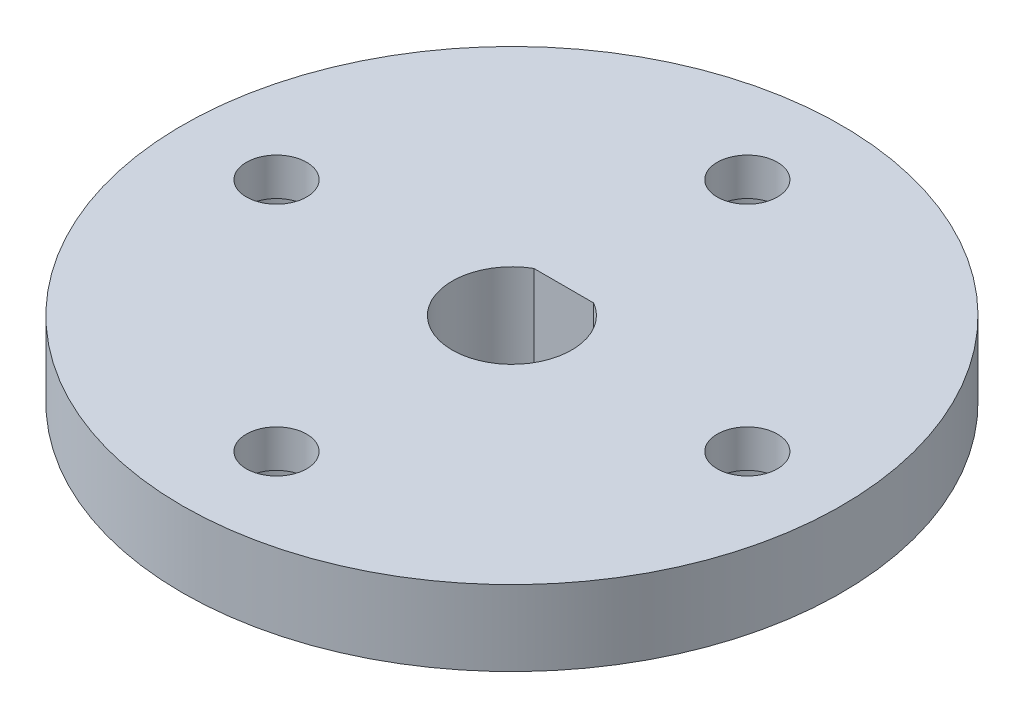
from build123d import *

# Parameters (mm, degrees)
SKETCH1_R               = 17.5
BOSS_EXTRUDE1_DEPTH     = 4
BOSS_EXTRUDE2_DEPTH     = 6
CUT_EXTRUDE1_DEPTH      = 26.465663156
CUT_EXTRUDE1_DEPTH_BACK = 26.465663156
SKETCH3_R               = 1.6
CUT_EXTRUDE2_DEPTH      = 1
CUT_EXTRUDE2_DEPTH_BACK = 23.716032156
CUT_EXTRUDE2_START      = -2.749631
SKETCH5_R               = 2.1
CHAMFER1_SIZE           = 0.5
SKETCH6_R               = 3
CUT_EXTRUDE3_DEPTH      = 2


with BuildPart() as part:
    # Sketch1 → Boss-Extrude1 (new body)
    with BuildSketch(Plane(origin=(0, 0, 0), x_dir=(1, 0, 0), z_dir=(0, 1, 0))):
        with Locations(Location((0, 0, 0), (0, 0, 270))):
            Circle(SKETCH1_R)
    extrude(amount=BOSS_EXTRUDE1_DEPTH)

    # Sketch2 → Boss-Extrude2 (add)
    with BuildSketch(Plane(origin=(0, 0, 0), x_dir=(1, 0, 0), z_dir=(0, 1, 0))):
        with BuildLine():
            Line((-2.87, 6.929148577), (2.87, 6.929148577))
            ThreePointArc((2.87, 6.929148577), (0, -7.5), (-2.87, 6.929148577))
        make_face()
    extrude(amount=-BOSS_EXTRUDE2_DEPTH)

    # Sketch3 → Cut-Extrude1 (cut, two sides: drawn at the far end of the back side and taken through both)
    with BuildSketch(Plane(origin=(0, 0, 0), x_dir=(1, 0, 0), z_dir=(0, 1, 0)).offset(-CUT_EXTRUDE1_DEPTH_BACK)):
        with Locations(Location((0, 12.5, 0), (0, 0, 270))):
            Circle(SKETCH3_R)
        with Locations(Location((12.5, 0, 0), (0, 0, 270))):
            Circle(SKETCH3_R)
        with Locations(Location((0, -12.5, 0), (0, 0, 270))):
            Circle(SKETCH3_R)
        with Locations(Location((-12.5, 0, 0), (0, 0, 270))):
            Circle(SKETCH3_R)
        with BuildLine():
            Line((-1.5875, 2.749630657), (1.5875, 2.749630657))
            ThreePointArc((1.5875, 2.749630657), (0, -3.175), (-1.5875, 2.749630657))
        make_face()
    extrude(amount=CUT_EXTRUDE1_DEPTH + CUT_EXTRUDE1_DEPTH_BACK, mode=Mode.SUBTRACT)

    # Sketch5 → Cut-Extrude2 (cut, two sides: drawn at the far end of the back side and taken through both)
    with BuildSketch(Plane.XY.offset(CUT_EXTRUDE2_START - CUT_EXTRUDE2_DEPTH_BACK)):
        with Locations(Location((0, -3, 0), (0, 0, 180))):
            Circle(SKETCH5_R)
    extrude(amount=CUT_EXTRUDE2_DEPTH + CUT_EXTRUDE2_DEPTH_BACK, mode=Mode.SUBTRACT)

    # Chamfer1
    chamfer1_edges = [part.edges().sort_by_distance(p)[0] for p in [
        (2.1, -3, -6.929148577),
    ]]
    chamfer(chamfer1_edges, length=CHAMFER1_SIZE)

    # Sketch6 → Cut-Extrude3 (cut)
    with BuildSketch(Plane(origin=(0, 0, 0), x_dir=(1, 0, 0), z_dir=(0, 1, 0))):
        with Locations(Location((0, 12.5, 0), (0, 0, 270))):
            Circle(SKETCH6_R)
        with Locations(Location((12.5, 0, 0), (0, 0, 270))):
            Circle(SKETCH6_R)
        with Locations(Location((0, -12.5, 0), (0, 0, 270))):
            Circle(SKETCH6_R)
        with Locations(Location((-12.5, 0, 0), (0, 0, 270))):
            Circle(SKETCH6_R)
    extrude(amount=CUT_EXTRUDE3_DEPTH, mode=Mode.SUBTRACT)


solid = part.part
